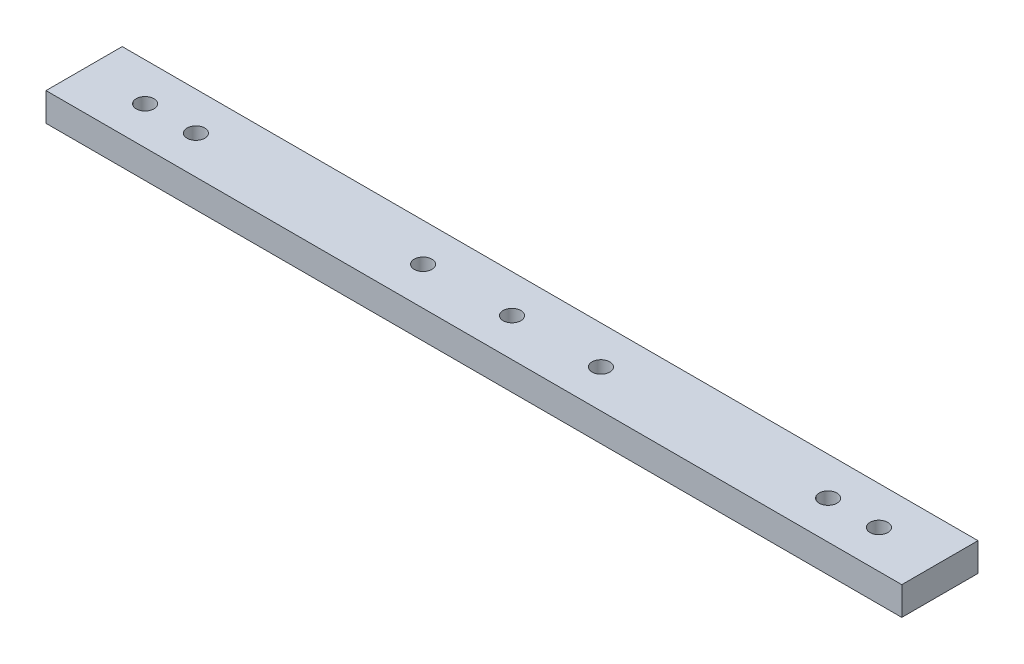
from build123d import *

# Parameters (mm, degrees)
SKETCH1_W           = 168.412
SKETCH1_H           = 15
BOSS_EXTRUDE1_DEPTH = 5.588
SKETCH2_R           = 1.75
CUT_EXTRUDE1_DEPTH  = 98.959199068
SKETCH3_R           = 1.75
CUT_EXTRUDE2_DEPTH  = 98.959199068


with BuildPart() as part:
    # Sketch1 → Boss-Extrude1 (new body)
    with BuildSketch(Plane(origin=(0, 0, 0), x_dir=(1, 0, 0), z_dir=(0, 1, 0))):
        with Locations((12.851084959, 4.52918108)):
            Rectangle(SKETCH1_W, SKETCH1_H)
    extrude(amount=BOSS_EXTRUDE1_DEPTH)

    # Sketch2 → Cut-Extrude1 (cut, through all)
    with BuildSketch(Plane(origin=(0, 5.588, 0), x_dir=(1, 0, 0), z_dir=(0, 1, 0))):
        with Locations(Location((-59.354915041, 4.52918108, 0), (0, 0, 270))):
            Circle(SKETCH2_R)
        with Locations(Location((-49.354915041, 4.52918108, 0), (0, 0, 270))):
            Circle(SKETCH2_R)
        with Locations(Location((75.057084959, 4.52918108, 0), (0, 0, 270))):
            Circle(SKETCH2_R)
        with Locations(Location((85.057084959, 4.52918108, 0), (0, 0, 270))):
            Circle(SKETCH2_R)
    extrude(amount=-CUT_EXTRUDE1_DEPTH, mode=Mode.SUBTRACT)

    # Sketch3 → Cut-Extrude2 (cut, through all)
    with BuildSketch(Plane(origin=(0, 5.588, 0), x_dir=(1, 0, 0), z_dir=(0, 1, 0))):
        with Locations(Location((-4.648915041, 4.52918108, 0), (0, 0, 270))):
            Circle(SKETCH3_R)
        with Locations(Location((30.351084959, 4.52918108, 0), (0, 0, 270))):
            Circle(SKETCH3_R)
        with Locations(Location((12.851084959, 4.52918108, 0), (0, 0, 270))):
            Circle(SKETCH3_R)
    extrude(amount=-CUT_EXTRUDE2_DEPTH, mode=Mode.SUBTRACT)


solid = part.part
